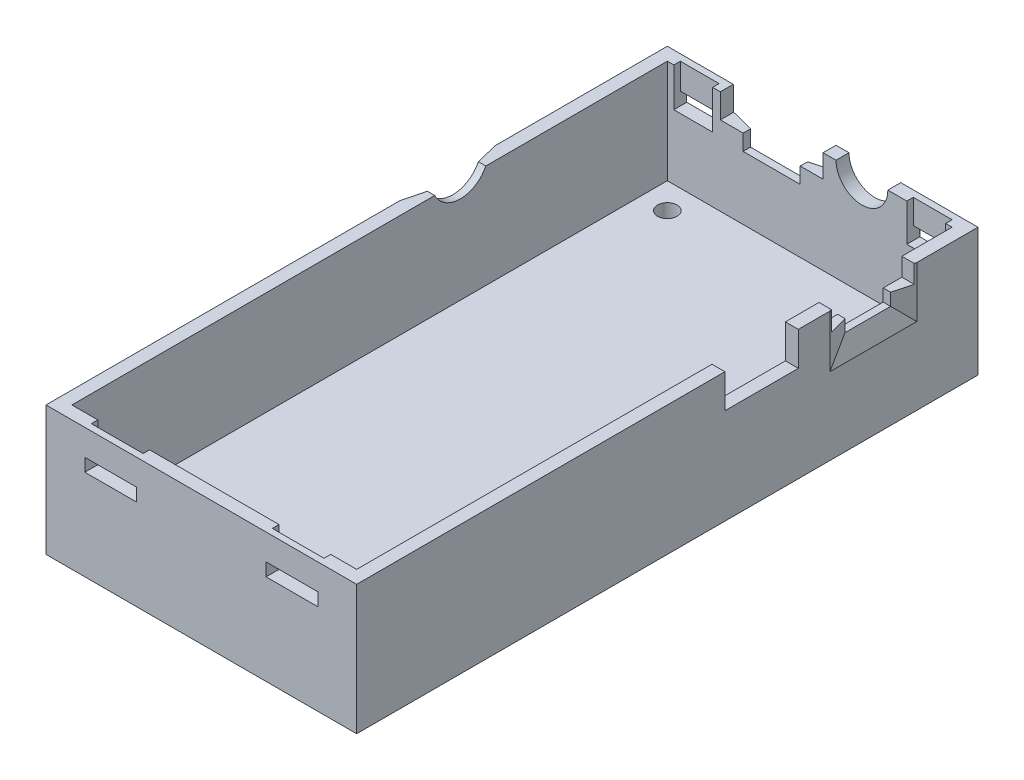
from build123d import *

# Parameters (mm, degrees)
SKETCH1_W           = 38.1
SKETCH1_H           = 76.2
BOSS_EXTRUDE1_DEPTH = 25.4
SKETCH2_R           = 1.2
CUT_EXTRUDE1_DEPTH  = 3.175
SKETCH4_W           = 34.925
SKETCH4_H           = 73.025
CUT_EXTRUDE2_DEPTH  = 22.225
CUT_EXTRUDE3_DEPTH  = 1.5875
CUT_EXTRUDE4_DEPTH  = 1.5875
SKETCH7_W           = 34.925
SKETCH7_H           = 9.525
CUT_EXTRUDE5_DEPTH  = 1.5875
CUT_EXTRUDE6_DEPTH  = 1.5875
CHAMFER1_SIZE       = 2.54
CHAMFER1_SIZE2      = 0.680590949
CHAMFER3_SIZE       = 2.54
CHAMFER3_SIZE2      = 0.680590949
CHAMFER4_SIZE       = 2.54
CHAMFER4_SIZE2      = 0.680590949
SKETCH10_W          = 6.35
SKETCH10_H          = 0.79375
SKETCH10_W_2        = 4.7625
SKETCH10_H_2        = 0.823022406
CUT_EXTRUDE7_DEPTH  = 4.7625
CUT_EXTRUDE8_REACH  = 88.661
SKETCH11_W          = 6.35
SKETCH11_H          = 1.5875
SKETCH14_W          = 4.7625
SKETCH14_H          = 1.5875
CUT_EXTRUDE9_DEPTH  = 1.5875


with BuildPart() as part:
    # Sketch1 → Boss-Extrude1 (new body)
    with BuildSketch(Plane(origin=(0, 0, 0), x_dir=(1, 0, 0), z_dir=(0, 1, 0))):
        with Locations((-19.05, -38.1)):
            Rectangle(SKETCH1_W, SKETCH1_H)
    extrude(amount=BOSS_EXTRUDE1_DEPTH)

    # Sketch2 → Cut-Extrude1 (cut)
    with BuildSketch(Plane(origin=(0, 0, 0), x_dir=(1, 0, 0), z_dir=(0, 1, 0))):
        with Locations(Location((-33.3375, -4.7625, 0), (0, 0, 270))):
            Circle(SKETCH2_R)
        with Locations(Location((-4.7625, -4.7625, 0), (0, 0, 270))):
            Circle(SKETCH2_R)
        with Locations(Location((-33.3375, -71.4375, 0), (0, 0, 270))):
            Circle(SKETCH2_R)
        with Locations(Location((-4.7625, -71.4375, 0), (0, 0, 270))):
            Circle(SKETCH2_R)
    extrude(amount=CUT_EXTRUDE1_DEPTH, mode=Mode.SUBTRACT)

    # Sketch4 → Cut-Extrude2 (cut)
    with BuildSketch(Plane(origin=(0, 25.4, 0), x_dir=(1, 0, 0), z_dir=(0, 1, 0))):
        with Locations((-19.05, -38.1)):
            Rectangle(SKETCH4_W, SKETCH4_H)
    extrude(amount=-CUT_EXTRUDE2_DEPTH, mode=Mode.SUBTRACT)

    # Sketch5 → Cut-Extrude3 (cut)
    with BuildSketch(Plane.ZY.offset(38.1)):
        with BuildLine():
            Line((76.2, 15.875), (30.115167454, 15.875))
            ThreePointArc((30.115167454, 15.875), (26.9833, 13.9375), (23.851432546, 15.875))
            Line((23.851432546, 15.875), (0, 15.875))
            Line((0, 15.875), (0, 25.4))
            Line((0, 25.4), (76.2, 25.4))
            Line((76.2, 25.4), (76.2, 15.875))
        make_face()
    extrude(amount=-CUT_EXTRUDE3_DEPTH, mode=Mode.SUBTRACT)

    # Sketch6 → Cut-Extrude4 (cut)
    with BuildSketch(Plane(origin=(0, 0, 0), x_dir=(-1, 0, 0), z_dir=(0, 0, -1))):
        with BuildLine():
            Line((30.0117, 12.8875), (30.0117, 15.875))
            Line((30.0117, 15.875), (36.5125, 15.875))
            Line((36.5125, 15.875), (36.5125, 25.4))
            Line((36.5125, 25.4), (1.5875, 25.4))
            Line((1.5875, 25.4), (1.5875, 15.7025))
            Line((1.5875, 15.7025), (9.4717, 15.7025))
            ThreePointArc((9.4717, 15.7025), (12.6467, 12.5275), (15.8217, 15.7025))
            Line((15.8217, 15.7025), (17.4117, 15.7025))
            Line((17.4117, 15.7025), (17.4117, 12.8875))
            Line((17.4117, 12.8875), (20.2117, 12.8875))
            Line((20.2117, 12.8875), (20.2117, 10.9375))
            Line((20.2117, 10.9375), (27.2117, 10.9375))
            Line((27.2117, 10.9375), (27.2117, 12.8875))
            Line((27.2117, 12.8875), (30.0117, 12.8875))
        make_face()
    extrude(amount=-CUT_EXTRUDE4_DEPTH, mode=Mode.SUBTRACT)

    # Sketch7 → Cut-Extrude5 (cut)
    with BuildSketch(Plane.XY.offset(76.2)):
        with Locations((-19.05, 20.6375)):
            Rectangle(SKETCH7_W, SKETCH7_H)
    extrude(amount=-CUT_EXTRUDE5_DEPTH, mode=Mode.SUBTRACT)

    # Sketch8 → Cut-Extrude6 (cut)
    with BuildSketch(Plane(origin=(0, 0, 0), x_dir=(0, 0, -1), z_dir=(1, 0, 0))):
        Polygon((-76.2, 25.4), (-76.2, 15.875), (-31.0375, 15.875), (-31.0375, 11.73125), (-22.0375, 11.73125), (-22.0375, 15.875), (-17.913122854, 15.875), (-17.913122854, 13.4775), (-15.633122854, 13.4775), (-15.628122854, 11.9775), (-10.038122854, 11.9775), (-10.033122854, 13.4775), (-7.753122854, 13.4775), (-7.753122854, 15.7025), (0, 15.7025), (0, 15.875), (0, 25.4), align=None)
    extrude(amount=-CUT_EXTRUDE6_DEPTH, mode=Mode.SUBTRACT)

    # Chamfer1
    chamfer1_edges = [part.edges().sort_by_distance(p)[0] for p in [
        (-38.1, 13.9375, 26.9833),
    ]]
    chamfer1_side = [part.faces().sort_by_distance(p)[0] for p in [
        (-38.1, 7.88589412, 38.18034211),
    ]]
    chamfer(chamfer1_edges, length=CHAMFER1_SIZE, length2=CHAMFER1_SIZE2, reference=chamfer1_side[0])

    # Chamfer3
    chamfer3_edges = [part.edges().sort_by_distance(p)[0] for p in [
        (-20.2117, 11.9125, 0),
        (-23.7117, 10.9375, 0),
        (-27.2117, 11.9125, 0),
    ]]
    chamfer3_side = [part.faces().sort_by_distance(p)[0] for p in [
        (-18.850549312, 7.148250007, 0),
    ]]
    chamfer(chamfer3_edges, length=CHAMFER3_SIZE, length2=CHAMFER3_SIZE2, reference=chamfer3_side[0])

    # Chamfer4
    chamfer4_edges = [part.edges().sort_by_distance(p)[0] for p in [
        (0, 12.7275, 10.035622854),
        (0, 12.7275, 15.630622854),
        (0, 11.9775, 12.833122854),
    ]]
    chamfer4_side = [part.faces().sort_by_distance(p)[0] for p in [
        (0, 7.556578666, 39.246012672),
    ]]
    chamfer(chamfer4_edges, length=CHAMFER4_SIZE, length2=CHAMFER4_SIZE2, reference=chamfer4_side[0])

    # Sketch10 → Cut-Extrude7 (cut)
    with BuildSketch(Plane(origin=(0, 15.875, 0), x_dir=(1, 0, 0), z_dir=(0, 1, 0))):
        with Locations((-30.1625, -75.009375)):
            Rectangle(SKETCH10_W, SKETCH10_H)
        with Locations((-33.3375, -1.190625)):
            Rectangle(SKETCH10_W_2, SKETCH10_H)
        with Locations((-4.7625, -1.190625)):
            Rectangle(SKETCH10_W_2, SKETCH10_H)
        with Locations((-7.9375, -75.024011203)):
            Rectangle(SKETCH10_W, SKETCH10_H_2)
    extrude(amount=-CUT_EXTRUDE7_DEPTH, mode=Mode.SUBTRACT)

    # Sketch11 → Cut-Extrude8 (cut, up to next)
    with BuildSketch(Plane.XY.offset(76.2), mode=Mode.PRIVATE) as cut_extrude8_sk1:
        with Locations((-30.1625, 11.90625)):
            Rectangle(SKETCH11_W, SKETCH11_H)
    cut_extrude8_tool1 = extrude(cut_extrude8_sk1.sketch, amount=-CUT_EXTRUDE8_REACH, mode=Mode.PRIVATE) & part.part
    # Sketch11 → Cut-Extrude8 (cut, up to next)
    with BuildSketch(Plane.XY.offset(76.2), mode=Mode.PRIVATE) as cut_extrude8_sk2:
        with Locations((-7.9375, 11.90625)):
            Rectangle(SKETCH11_W, SKETCH11_H)
    cut_extrude8_tool2 = extrude(cut_extrude8_sk2.sketch, amount=-CUT_EXTRUDE8_REACH, mode=Mode.PRIVATE) & part.part
    add(cut_extrude8_tool1.solids().sort_by_distance((-30.1625, 11.90625, 76.2))[0], mode=Mode.SUBTRACT)
    add(cut_extrude8_tool2.solids().sort_by_distance((-7.9375, 11.90625, 76.2))[0], mode=Mode.SUBTRACT)

    # Sketch14 → Cut-Extrude9 (cut)
    with BuildSketch(Plane(origin=(0, 0, 0), x_dir=(-1, 0, 0), z_dir=(0, 0, -1))):
        with Locations((33.3375, 11.90625)):
            Rectangle(SKETCH14_W, SKETCH14_H)
        with Locations((4.7625, 11.90625)):
            Rectangle(SKETCH14_W, SKETCH14_H)
    extrude(amount=-CUT_EXTRUDE9_DEPTH, mode=Mode.SUBTRACT)


solid = part.part
